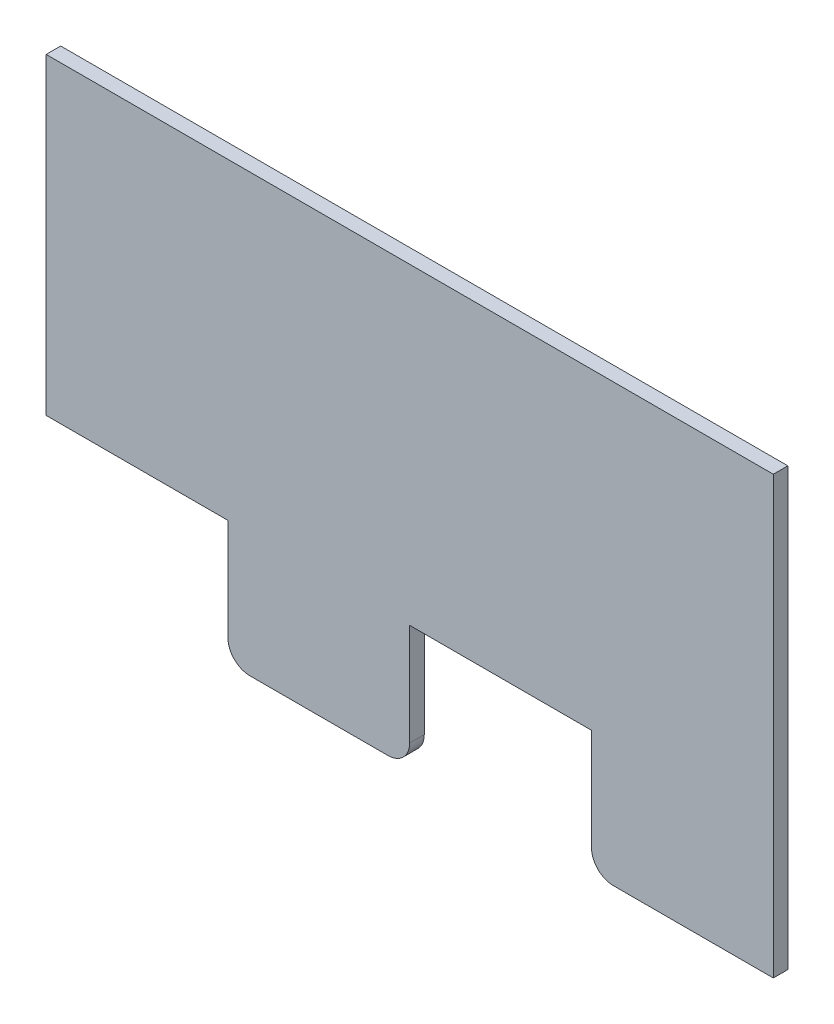
from build123d import *

# Parameters (mm, degrees)
BOSS_EXTRUDE1_DEPTH = 2


with BuildPart() as part:
    # Sketch1 → Boss-Extrude1 (new body)
    with BuildSketch(Plane.XY):
        with BuildLine():
            Line((0, -3), (25, -3))
            Line((25, -3), (25, -17))
            ThreePointArc((25, -17), (25.878679656, -19.121320344), (28, -20))
            Line((28, -20), (50, -20))
            Line((50, -20), (50, 40))
            Line((50, 40), (-50, 40))
            Line((-50, 40), (-50, -3))
            Line((-50, -3), (-25, -3))
            Line((-25, -3), (-25, -17))
            ThreePointArc((-25, -17), (-24.121320344, -19.121320344), (-22, -20))
            Line((-22, -20), (-3, -20))
            ThreePointArc((-3, -20), (-0.878679656, -19.121320344), (0, -17))
            Line((0, -17), (0, -3))
        make_face()
    extrude(amount=BOSS_EXTRUDE1_DEPTH)


solid = part.part
